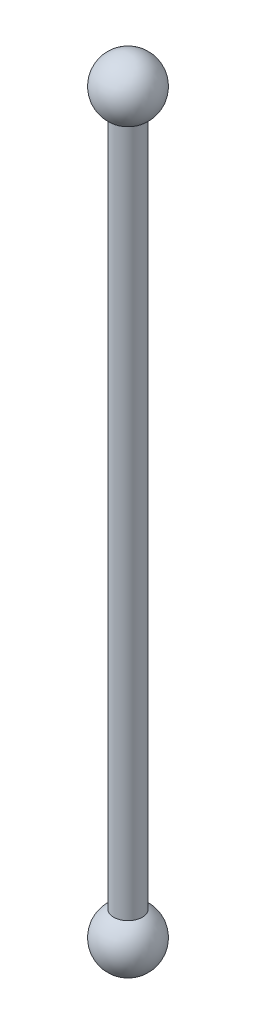
from build123d import *


with BuildPart() as part:
    # Sketch1 → Revolve1 (revolve)
    with BuildSketch(Plane.XY, mode=Mode.PRIVATE) as revolve1_sk:
        with BuildLine():
            Line((0, -9.330127019), (0, 60))
            Line((0, 60), (2.5, 60))
            Line((2.5, 60), (2.5, 0))
            ThreePointArc((2.5, 0), (4.829629131, -5.624222244), (0, -9.330127019))
        make_face()
    revolve1 = revolve(revolve1_sk.sketch.rotate(Axis((0, -9.330127019, 0), (0, 1, 0)), 180), axis=Axis((0, -9.330127019, 0), (0, 1, 0)))

    # Mirror1: Revolve1 across plane
    add(revolve1.mirror(Plane(origin=(2.5, 60, 0), x_dir=(0, 0, 1), z_dir=(0, 1, 0))))


solid = part.part
